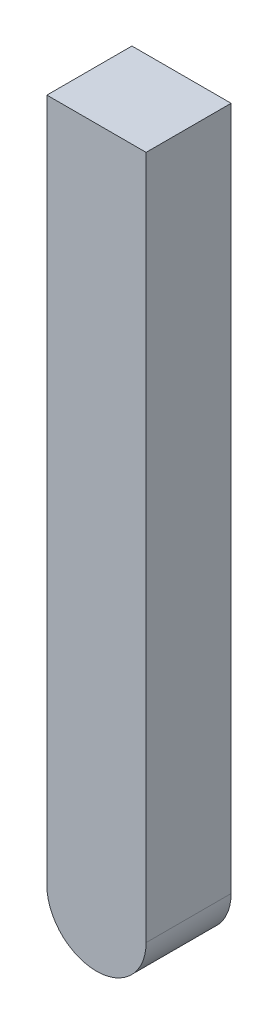
from build123d import *

# Parameters (mm, degrees)
RESSALTO_EXTRUS_O1_DEPTH = 0.3


with BuildPart() as part:
    # Esboço1 → Ressalto-extrusão1 (new, symmetric)
    with BuildSketch(Plane.XY):
        with BuildLine():
            Line((-0.35, 2.415), (-0.35, -2.415))
            ThreePointArc((-0.35, -2.415), (0, -2.765), (0.35, -2.415))
            Line((0.35, -2.415), (0.35, 2.415))
            Line((0.35, 2.415), (-0.35, 2.415))
        make_face()
    extrude(amount=RESSALTO_EXTRUS_O1_DEPTH, both=True)


solid = part.part
